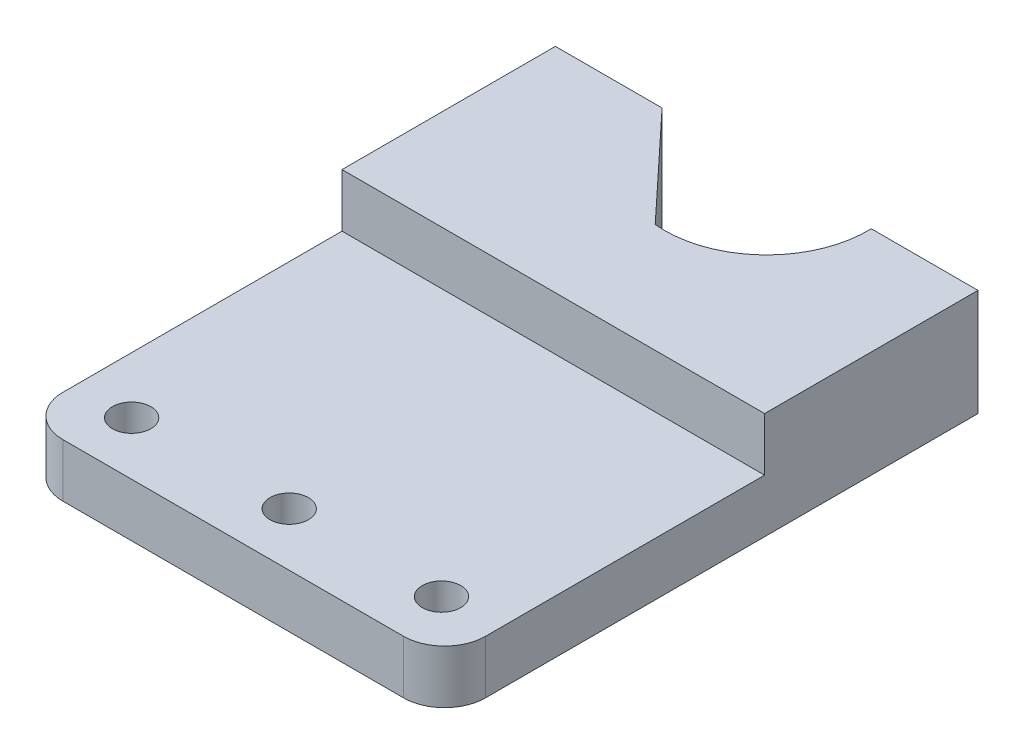
from build123d import *

# Parameters (mm, degrees)
SKETCH1_R           = 2.286
BOSS_EXTRUDE1_DEPTH = 12.7
SKETCH5_R           = 2.286
CUT_EXTRUDE3_DEPTH  = 12.7
FILLET1_R           = 4.87
FILLET2_R           = 4.87
SKETCH7_W           = 50.304618045
SKETCH7_H           = 38.1
CUT_EXTRUDE4_DEPTH  = 6.35


with BuildPart() as part:
    # Sketch1 → Boss-Extrude1 (new body)
    with BuildSketch(Plane(origin=(0, 0, 0), x_dir=(1, 0, 0), z_dir=(0, 1, 0))):
        with BuildLine():
            Line((-291.755501553, 191.396492393), (-280.151228022, 178.973093671))
            ThreePointArc((-280.151228022, 178.973093671), (-270.685286175, 182.170263236), (-266.850883508, 191.396492393))
            Line((-266.850883508, 191.396492393), (-254.150883508, 191.396492393))
            Line((-254.150883508, 191.396492393), (-254.150883508, 127.896492393))
            Line((-254.150883508, 127.896492393), (-304.455501553, 127.896492393))
            Line((-304.455501553, 127.896492393), (-304.455501553, 191.396492393))
            Line((-304.455501553, 191.396492393), (-291.755501553, 191.396492393))
        make_face()
        with Locations(Location((-297.746130931, 134.246492393, 0), (0, 0, 270))):
            Circle(SKETCH1_R, mode=Mode.SUBTRACT)
        with Locations(Location((-278.990383135, 134.246492393, 0), (0, 0, 270))):
            Circle(SKETCH1_R, mode=Mode.SUBTRACT)
        with Locations(Location((-260.86025413, 134.246492393, 0), (0, 0, 270))):
            Circle(SKETCH1_R, mode=Mode.SUBTRACT)
    extrude(amount=BOSS_EXTRUDE1_DEPTH)

    # Sketch5 → Cut-Extrude3 (cut)
    with BuildSketch(Plane(origin=(0, 0, -191.396492393), x_dir=(-1, 0, 0), z_dir=(0, 0, -1))):
        with Locations((260.500883508, 6.35)):
            Circle(SKETCH5_R)
        with Locations((298.105501553, 6.35)):
            Circle(SKETCH5_R)
    extrude(amount=-CUT_EXTRUDE3_DEPTH, mode=Mode.SUBTRACT)

    # Fillet1
    fillet1_edges = [part.edges().sort_by_distance(p)[0] for p in [
        (-304.455501553, 6.35, -127.896492393),
    ]]
    fillet(fillet1_edges, radius=FILLET1_R)

    # Fillet2
    fillet2_edges = [part.edges().sort_by_distance(p)[0] for p in [
        (-254.150883508, 6.35, -127.896492393),
    ]]
    fillet(fillet2_edges, radius=FILLET2_R)

    # Sketch7 → Cut-Extrude4 (cut)
    with BuildSketch(Plane(origin=(0, 12.7, 0), x_dir=(1, 0, 0), z_dir=(0, 1, 0))):
        with Locations((-279.303192531, 146.946492393)):
            Rectangle(SKETCH7_W, SKETCH7_H)
    extrude(amount=-CUT_EXTRUDE4_DEPTH, mode=Mode.SUBTRACT)


solid = part.part
